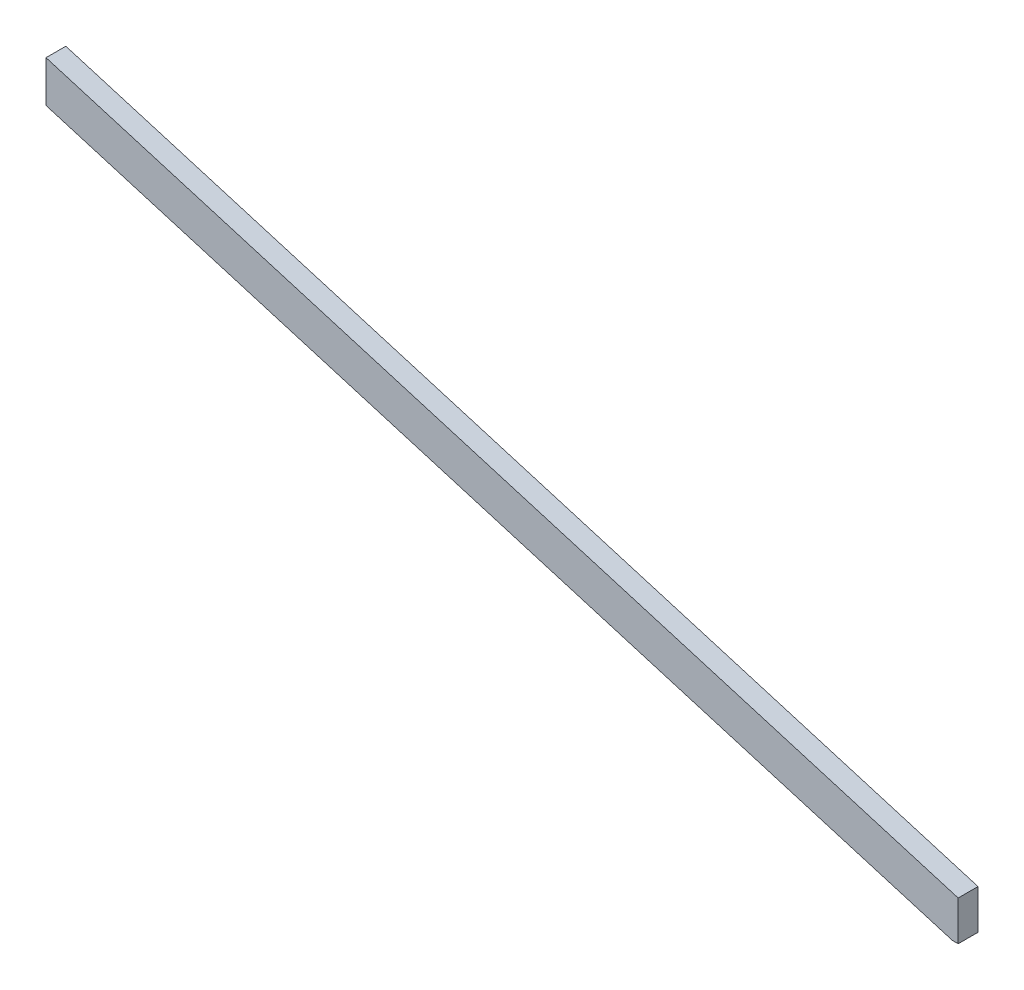
from build123d import *

# Parameters (mm, degrees)
BOSS_EXTRUDE2_DEPTH = 50.8


with BuildPart() as part:
    # Sketch3 → Boss-Extrude2 (new body)
    with BuildSketch(Plane.XY.offset(50.8)):
        Polygon((-1384.025, 292.740485768), (937.968055241, -398.75), (952.775, -398.75), (952.775, -297.15), (-1384.025, 398.75), align=None)
    extrude(amount=BOSS_EXTRUDE2_DEPTH)


solid = part.part
